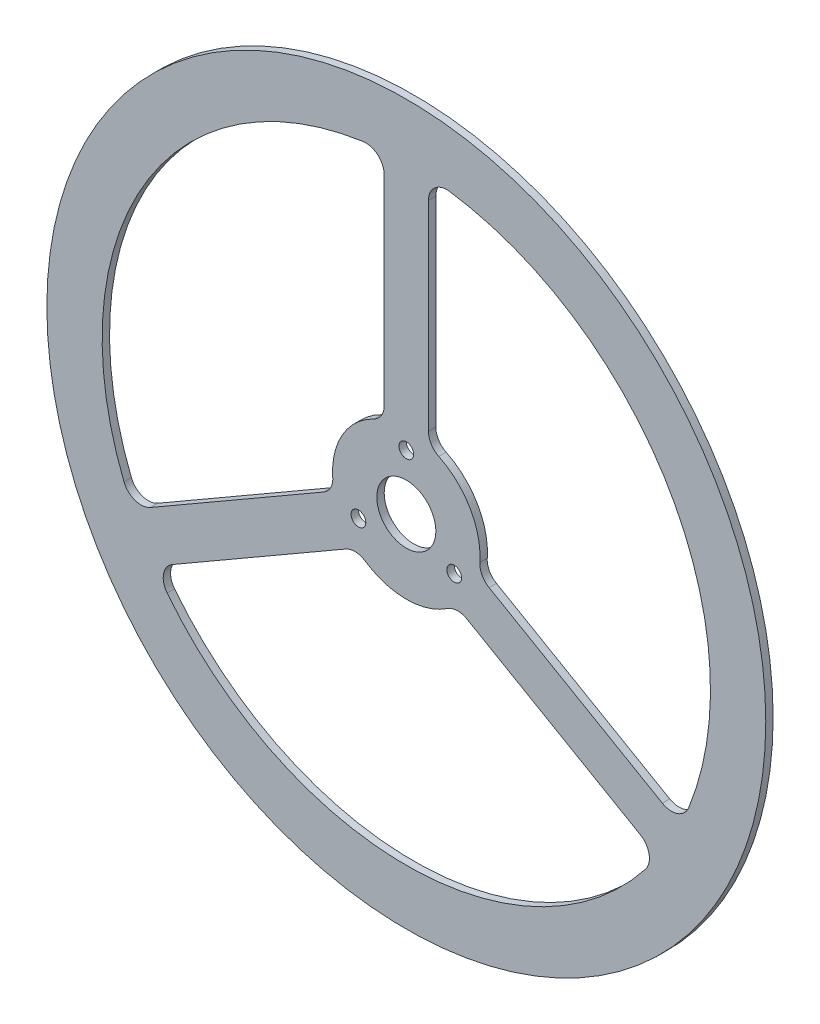
from build123d import *

# Parameters (mm, degrees)
SKETCH_1_R               = 97.5
EXTRUDE_1_DEPTH          = 2
SKETCH_2_R               = 8
CUT_EXTRUDE_1_DEPTH      = 138.900326323
SKETCH_3_R               = 2
CUT_EXTRUDE_2_DEPTH      = 138.900326323
PATTERN_CIRCULAR_1_COUNT = 3


with BuildPart() as part:
    # 草图1 → 凸台-拉伸1 (new body)
    with BuildSketch(Plane.XY):
        Circle(SKETCH_1_R)
    extrude(amount=EXTRUDE_1_DEPTH)

    # 草图2 → 切除-拉伸1 (cut, through all)
    with BuildSketch(Plane(origin=(0, 0, 0), x_dir=(-1, 0, 0), z_dir=(0, 0, -1))):
        Circle(SKETCH_2_R)
        with BuildLine():
            Line((-6, 22.449944321), (-6, 76.715383073))
            ThreePointArc((-6, 76.715383073), (-7.724972298, 80.493503445), (-11.709677419, 81.664762626))
            ThreePointArc((-11.709677419, 81.664762626), (-71.447095812, 41.25), (-76.578597738, -30.691503198))
            ThreePointArc((-76.578597738, -30.691503198), (-73.571904972, -33.556729469), (-69.437470602, -33.161539114))
            Line((-69.437470602, -33.161539114), (-22.442222095, -6.028819738))
            ThreePointArc((-22.442222095, -6.028819738), (-20.529613904, -4.050051677), (-19.953777676, -1.358954175))
            ThreePointArc((-19.953777676, -1.358954175), (-17.320508076, 10), (-8.8, 17.959955457))
            ThreePointArc((-8.8, 17.959955457), (-6.757359313, 19.80419301), (-6, 22.449944321))
        make_face()
        with BuildLine():
            Line((6, 22.449944321), (6, 76.715383073))
            ThreePointArc((6, 76.715383073), (7.724972298, 80.493503445), (11.709677419, 81.664762626))
            ThreePointArc((11.709677419, 81.664762626), (71.447095812, 41.25), (76.578597738, -30.691503198))
            ThreePointArc((76.578597738, -30.691503198), (73.571904972, -33.556729469), (69.437470602, -33.161539114))
            Line((69.437470602, -33.161539114), (22.442222095, -6.028819738))
            ThreePointArc((22.442222095, -6.028819738), (20.529613904, -4.050051677), (19.953777676, -1.358954175))
            ThreePointArc((19.953777676, -1.358954175), (17.320508076, 10), (8.8, 17.959955457))
            ThreePointArc((8.8, 17.959955457), (6.757359313, 19.80419301), (6, 22.449944321))
        make_face()
        with BuildLine():
            Line((16.442222095, -16.421124583), (63.437470602, -43.553843959))
            ThreePointArc((63.437470602, -43.553843959), (65.846932674, -46.936773976), (64.868920318, -50.973259428))
            ThreePointArc((64.868920318, -50.973259428), (0, -82.5), (-64.868920318, -50.973259428))
            ThreePointArc((-64.868920318, -50.973259428), (-65.846932674, -46.936773976), (-63.437470602, -43.553843959))
            Line((-63.437470602, -43.553843959), (-16.442222095, -16.421124583))
            ThreePointArc((-16.442222095, -16.421124583), (-13.772254591, -15.754141332), (-11.153777676, -16.601001282))
            ThreePointArc((-11.153777676, -16.601001282), (0, -20), (11.153777676, -16.601001282))
            ThreePointArc((11.153777676, -16.601001282), (13.772254591, -15.754141332), (16.442222095, -16.421124583))
        make_face()
    extrude(amount=-CUT_EXTRUDE_1_DEPTH, mode=Mode.SUBTRACT)

    # 草图3 → 切除-拉伸2 (cut, through all)
    with BuildSketch(Plane(origin=(0, 0, 0), x_dir=(-1, 0, 0), z_dir=(0, 0, -1))):
        with Locations((0, 15)):
            Circle(SKETCH_3_R)
    cut_extrude_2 = extrude(amount=-CUT_EXTRUDE_2_DEPTH, mode=Mode.SUBTRACT)

    # 阵列(圆周)1: 切除-拉伸2 ×3 about axis
    pattern_circular_1_axis = Axis((0, 0, 0), (0, 0, 1))
    for i in range(1, PATTERN_CIRCULAR_1_COUNT):
        add(cut_extrude_2.rotate(pattern_circular_1_axis, i * 360 / PATTERN_CIRCULAR_1_COUNT), mode=Mode.SUBTRACT)


solid = part.part
